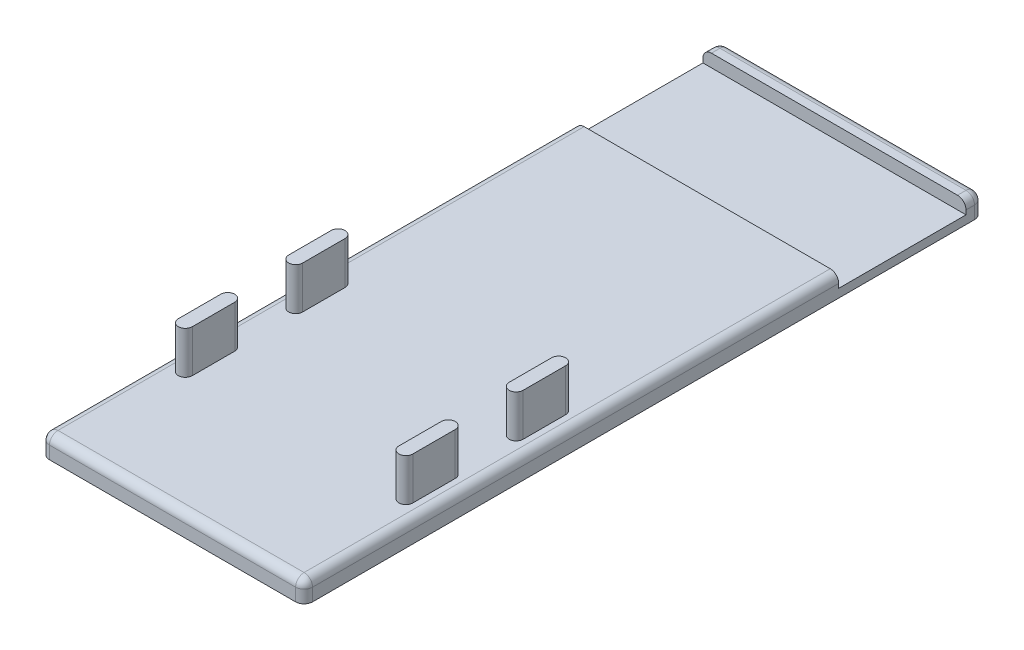
from build123d import *

# Parameters (mm, degrees)
SKETCH1_W            = 78.74
SKETCH1_H            = 203.2
BOSS_EXTRUDE1_DEPTH  = 6.35
BOSS_EXTRUDE2_DEPTH  = 12.7
LPATTERN2_COUNT      = 2
LPATTERN2_PITCH      = 65.9892
LPATTERN2_COUNT_DIR2 = 2
LPATTERN2_PITCH_DIR2 = 33.02
SKETCH3_W            = 38.1
SKETCH3_H            = 3.81
CUT_EXTRUDE1_DEPTH   = 219.753583056
FILLET1_R            = 2.54


with BuildPart() as part:
    # Sketch1 → Boss-Extrude1 (new body)
    with BuildSketch(Plane(origin=(0, 0, 0), x_dir=(1, 0, 0), z_dir=(0, 1, 0))):
        with Locations((39.37, -101.6)):
            Rectangle(SKETCH1_W, SKETCH1_H)
    extrude(amount=BOSS_EXTRUDE1_DEPTH)

    # Sketch2 → Boss-Extrude2 (add)
    with BuildSketch(Plane(origin=(0, 6.35, 0), x_dir=(1, 0, 0), z_dir=(0, 1, 0))):
        with BuildLine():
            Line((4.2926, -133.35), (4.2926, -120.65))
            ThreePointArc((4.2926, -120.65), (6.3754, -118.5672), (8.4582, -120.65))
            Line((8.4582, -120.65), (8.4582, -133.35))
            ThreePointArc((8.4582, -133.35), (6.3754, -135.4328), (4.2926, -133.35))
        make_face()
    boss_extrude2 = extrude(amount=BOSS_EXTRUDE2_DEPTH)

    # LPattern2: Boss-Extrude2 2 × 2
    with Locations(*[(i * LPATTERN2_PITCH, 0, j * LPATTERN2_PITCH_DIR2) for i in range(LPATTERN2_COUNT) for j in range(LPATTERN2_COUNT_DIR2) if (i, j) != (0, 0)]):
        add(boss_extrude2)

    # Sketch3 → Cut-Extrude1 (cut, through all)
    with BuildSketch(Plane(origin=(78.74, 0, 0), x_dir=(0, 0, -1), z_dir=(1, 0, 0))):
        with Locations((-24.13, 4.445)):
            Rectangle(SKETCH3_W, SKETCH3_H)
    extrude(amount=-CUT_EXTRUDE1_DEPTH, mode=Mode.SUBTRACT)

    # Fillet1
    fillet1_edges = [part.edges().sort_by_distance(p)[0] for p in [
        (78.74, 6.35, 123.19),
        (39.37, 6.35, 0),
        (0, 6.35, 2.54),
        (78.74, 6.35, 2.54),
        (0, 6.35, 123.19),
        (0, 3.175, 0),
        (78.74, 3.175, 0),
        (78.74, 3.175, 203.2),
        (0, 3.175, 203.2),
        (39.37, 6.35, 203.2),
    ]]
    fillet(fillet1_edges, radius=FILLET1_R)


solid = part.part
